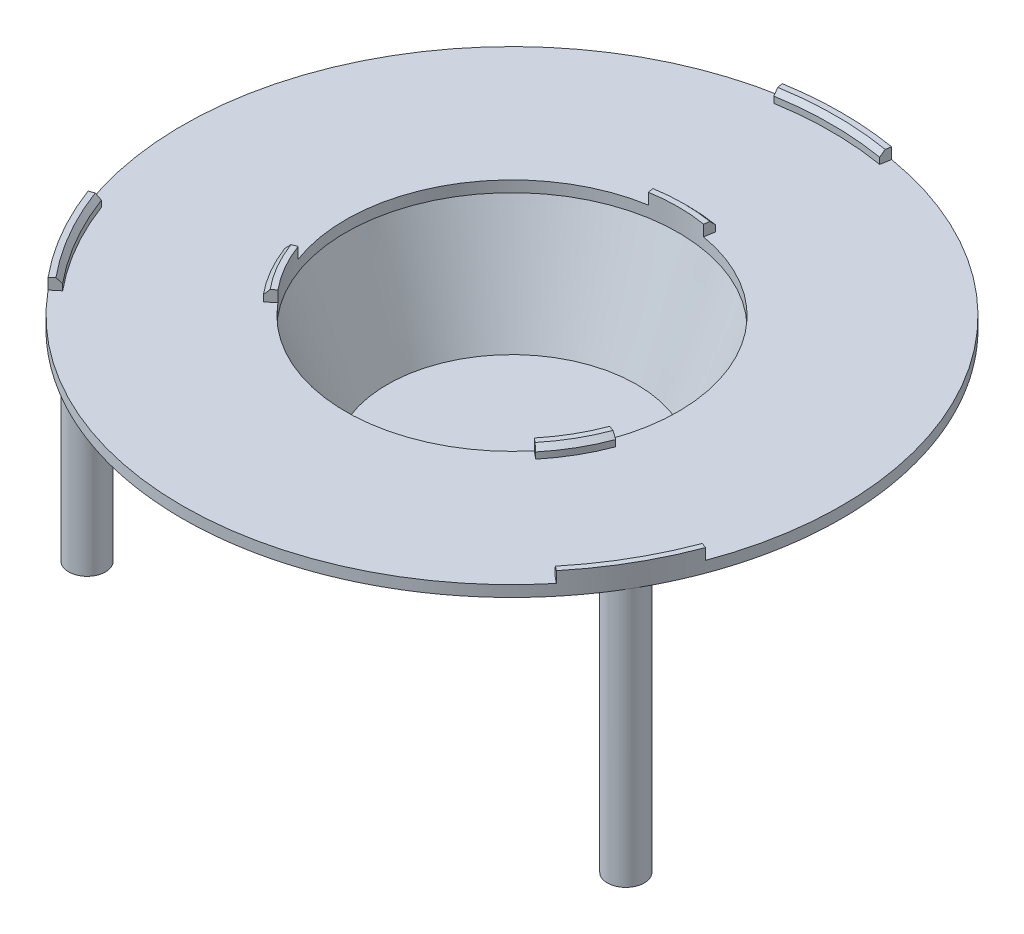
from build123d import *
from build123d.topology import SkipClean

# Parameters (mm, degrees)
SKETCH2_R           = 89.2
SKETCH2_R_2         = 45.006
BOSS_EXTRUDE1_DEPTH = 3
BOSS_EXTRUDE2_DEPTH = 3
CHAMFER1_SIZE       = 1.3
SKETCH4_R           = 5
BOSS_EXTRUDE3_DEPTH = 70


with BuildPart() as part:
    # Sketch2 → Boss-Extrude1 (new body)
    with BuildSketch(Plane(origin=(0, 0, 0), x_dir=(1, 0, 0), z_dir=(0, 1, 0))):
        with Locations(Location((0, 0, 0), (0, 0, 270))):
            Circle(SKETCH2_R)
        with Locations(Location((0, 0, 0), (0, 0, 270))):
            Circle(SKETCH2_R_2, mode=Mode.SUBTRACT)
    extrude(amount=BOSS_EXTRUDE1_DEPTH)

    # Sketch3 → Boss-Extrude2 (add)
    with SkipClean():  # the faces are left unmerged after this step: merging them gives an invalid solid
        with BuildSketch(Plane(origin=(0, 3, 0), x_dir=(1, 0, 0), z_dir=(0, 1, 0))):
            with BuildLine():
                ThreePointArc((-66.624574207, -55.010236427), (-74.824594887, -43.2), (-80.952549318, -30.193455566))
                Line((-80.952549318, -30.193455566), (-83.576011564, -31.171947181))
                ThreePointArc((-83.576011564, -31.171947181), (-77.249466018, -44.6), (-68.783703926, -56.792975571))
                Line((-68.783703926, -56.792975571), (-66.624574207, -55.010236427))
            make_face()
            with BuildLine():
                Line((-36.864055492, -30.437724105), (-34.704925772, -28.654984961))
                ThreePointArc((-34.704925772, -28.654984961), (-38.976339323, -22.503), (-42.168407808, -15.727854875))
                Line((-42.168407808, -15.727854875), (-44.791870054, -16.70634649))
                ThreePointArc((-44.791870054, -16.70634649), (-41.401210453, -23.903), (-36.864055492, -30.437724105))
            make_face()
            with BuildLine():
                ThreePointArc((42.168407808, -15.727854875), (38.976339323, -22.503), (34.704925772, -28.654984961))
                Line((34.704925772, -28.654984961), (36.864055492, -30.437724105))
                ThreePointArc((36.864055492, -30.437724105), (41.401210453, -23.903), (44.791870054, -16.70634649))
                Line((44.791870054, -16.70634649), (42.168407808, -15.727854875))
            make_face()
            with BuildLine():
                Line((66.624574207, -55.010236427), (68.783703926, -56.792975571))
                ThreePointArc((68.783703926, -56.792975571), (77.249466018, -44.6), (83.576011564, -31.171947181))
                Line((83.576011564, -31.171947181), (80.952549318, -30.193455566))
                ThreePointArc((80.952549318, -30.193455566), (74.824594887, -43.2), (66.624574207, -55.010236427))
            make_face()
            with BuildLine():
                ThreePointArc((14.792307638, 87.964922752), (0, 89.2), (-14.792307638, 87.964922752))
                Line((-14.792307638, 87.964922752), (-14.327975111, 85.203691993))
                ThreePointArc((-14.327975111, 85.203691993), (0, 86.4), (14.327975111, 85.203691993))
                Line((14.327975111, 85.203691993), (14.792307638, 87.964922752))
            make_face()
            with BuildLine():
                Line((-7.927814562, 47.144070595), (-7.463482035, 44.382839836))
                ThreePointArc((-7.463482035, 44.382839836), (0, 45.006), (7.463482035, 44.382839836))
                Line((7.463482035, 44.382839836), (7.927814562, 47.144070595))
                ThreePointArc((7.927814562, 47.144070595), (0, 47.806), (-7.927814562, 47.144070595))
            make_face()
        extrude(amount=BOSS_EXTRUDE2_DEPTH)

    # Chamfer1
    chamfer1_edges = [part.edges().sort_by_distance(p)[0] for p in [
        (-74.824594887, 6, 43.2),
        (0, 6, -47.806),
        (-41.401210453, 6, 23.903),
        (41.401210453, 6, 23.903),
        (74.824594887, 6, 43.2),
        (0, 6, -86.4),
    ]]
    chamfer(chamfer1_edges, length=CHAMFER1_SIZE)

    # Sketch4 → Boss-Extrude3 (add)
    with SkipClean():  # the faces are left unmerged after this step: merging them gives an invalid solid
        with BuildSketch(Plane.XZ):
            with Locations(Location((-72.919338999, 42.1, 0), (0, 0, 149.999627059))):
                Circle(SKETCH4_R)
            with Locations(Location((72.919338999, 42.1, 0), (0, 0, 29.999627059))):
                Circle(SKETCH4_R)
            with Locations(Location((0, -84.2, 0), (0, 0, 270))):
                Circle(SKETCH4_R)
        extrude(amount=BOSS_EXTRUDE3_DEPTH)

    # Sketch7 → Revolve1 (revolve)
    with SkipClean():  # the faces are left unmerged after this step: merging them gives an invalid solid
        with BuildSketch(Plane(origin=(0, 0, 0), x_dir=(0, 0, -1), z_dir=(1, 0, 0)), mode=Mode.PRIVATE) as revolve1_sk:
            Polygon((-48.006, 0), (-45.006, 0), (-33.75, -30), (0, -30), (0, -32.81), (-35.695688, -32.81), align=None)
        revolve(revolve1_sk.sketch.rotate(Axis((0, -30, 0), (0, 1, 0)), 189.545631171), axis=Axis((0, -30, 0), (0, 1, 0)))


solid = part.part
